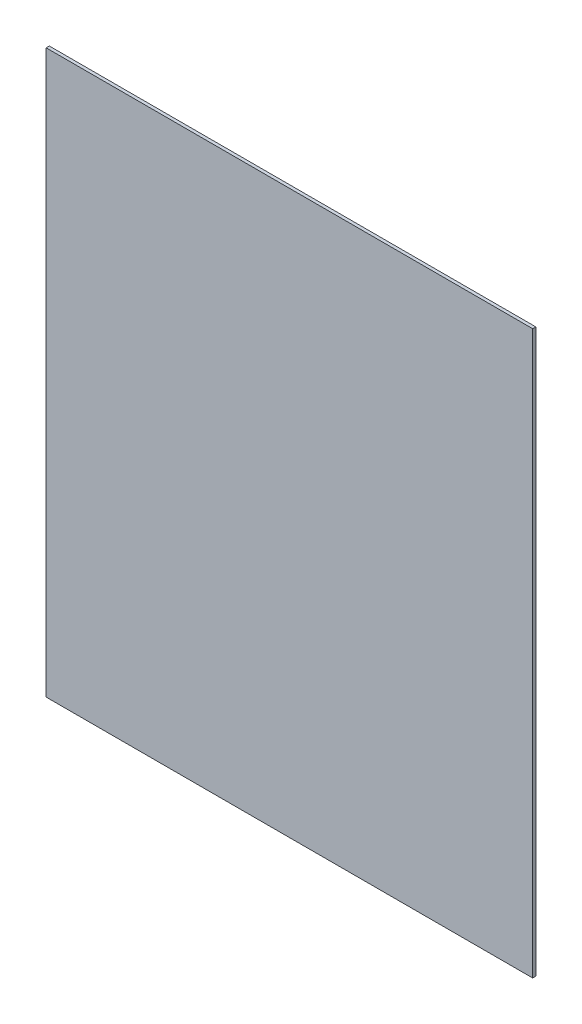
from build123d import *

# Parameters (mm, degrees)
SKETCH1_W           = 770
SKETCH1_H           = 890
BOSS_EXTRUDE1_DEPTH = 5


with BuildPart() as part:
    # Sketch1 → Boss-Extrude1 (new body)
    with BuildSketch(Plane.XY):
        Rectangle(SKETCH1_W, SKETCH1_H)
    extrude(amount=BOSS_EXTRUDE1_DEPTH)


solid = part.part
